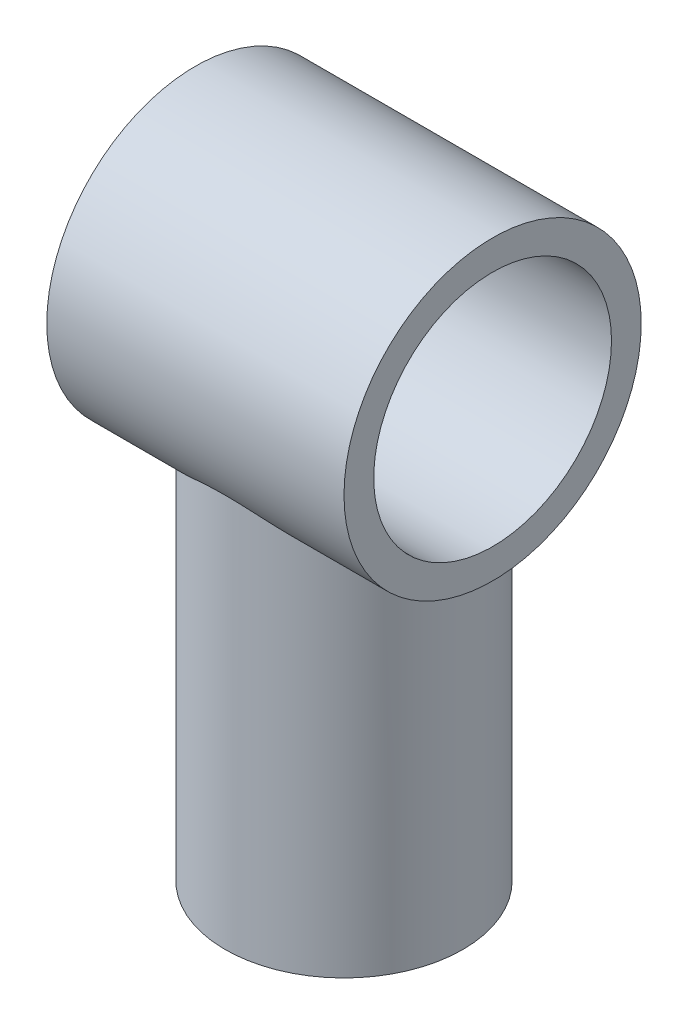
from build123d import *

# Parameters (mm, degrees)
EXTRUDE_1_DEPTH          = 50
EXTRUDE_1_DEPTH_BACK     = 50
SKETCH_1_R               = 50
CUT_EXTRUDE_2_DEPTH      = 50
CUT_EXTRUDE_2_DEPTH_BACK = 50
SKETCH_2_R               = 40
EXTRUDE_2_REACH          = 225.861
EXTRUDE_2_END_RADIUS     = 50
SKETCH_3_R               = 40


with BuildPart() as part:
    # 草图1 → 凸台-拉伸1 (new, two sides: drawn at the far end of the back side and taken through both)
    with BuildSketch(Plane(origin=(0, 0, 0), x_dir=(0, 0, -1), z_dir=(1, 0, 0)).offset(-EXTRUDE_1_DEPTH_BACK)):
        Circle(SKETCH_1_R)
    extrude(amount=EXTRUDE_1_DEPTH + EXTRUDE_1_DEPTH_BACK)

    # 草图2 → 切除-拉伸2 (cut, two sides: drawn at the far end of the back side and taken through both)
    with BuildSketch(Plane(origin=(0, 0, 0), x_dir=(0, 0, -1), z_dir=(1, 0, 0)).offset(-CUT_EXTRUDE_2_DEPTH_BACK)):
        Circle(SKETCH_2_R)
    extrude(amount=CUT_EXTRUDE_2_DEPTH + CUT_EXTRUDE_2_DEPTH_BACK, mode=Mode.SUBTRACT)

    # 凸台-拉伸2: up to this cylinder (the profile starts outside it)
    extrude_2_end = Plane(origin=(0, 0, 0), z_dir=(-1, 0, 0)) * Cylinder(EXTRUDE_2_END_RADIUS, 552.722, mode=Mode.PRIVATE)
    # 草图3 → 凸台-拉伸2 (add, up to the surface)
    with BuildSketch(Plane(origin=(0, -162.4, 0), x_dir=(-1, 0, 0), z_dir=(0, -1, 0)), mode=Mode.PRIVATE) as extrude_2_sk1:
        Circle(SKETCH_3_R)
    extrude_2_tool1 = extrude(extrude_2_sk1.sketch, amount=-EXTRUDE_2_REACH, mode=Mode.PRIVATE) - extrude_2_end
    add(extrude_2_tool1.solids().sort_by_distance((0, -162.4, 0))[0])


solid = part.part
